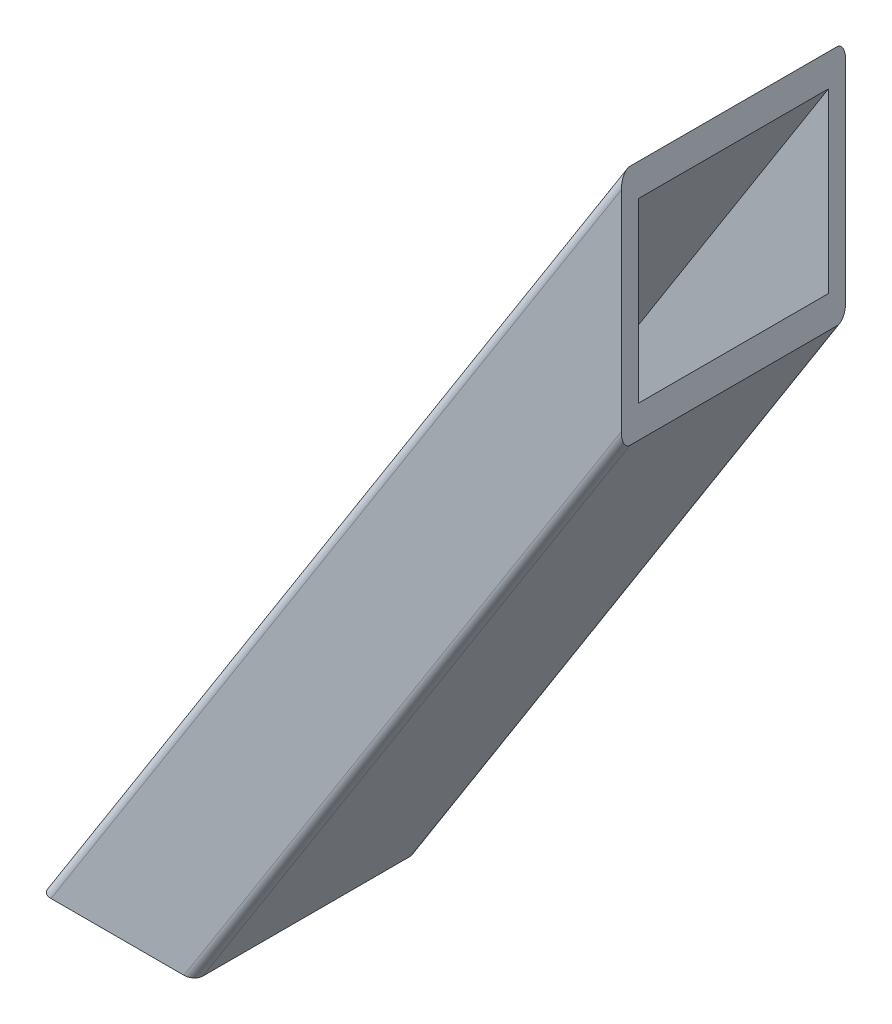
from build123d import *

# Parameters (mm, degrees)
BOSS_EXTRUDE1_DEPTH = 26
SHELL1_T            = -2
CUT_EXTRUDE1_REACH  = 120.071
SKETCH2_W           = 13.02701198
SKETCH2_H           = 22
FILLET1_R           = 1


with BuildPart() as part:
    # Sketch1 → Boss-Extrude1 (new body)
    with BuildSketch(Plane.XY):
        Polygon((0, 0), (-17.764107246, 0), (49.485727329, 106), (49.485727329, 78), align=None)
    extrude(amount=BOSS_EXTRUDE1_DEPTH)

    # Shell1
    shell1_openings = [part.faces().sort_by_distance(p)[0] for p in [
        (49.485727329, 92, 13),
    ]]
    offset(amount=SHELL1_T, openings=shell1_openings, kind=Kind.INTERSECTION)

    # Sketch2 → Cut-Extrude1 (cut, up to next)
    with BuildSketch(Plane(origin=(0, 2, 0), x_dir=(1, 0, 0), z_dir=(0, 1, 0)), mode=Mode.PRIVATE) as cut_extrude1_sk1:
        with Locations((-7.61318882, -13)):
            Rectangle(SKETCH2_W, SKETCH2_H)
    cut_extrude1_tool1 = extrude(cut_extrude1_sk1.sketch, amount=-CUT_EXTRUDE1_REACH, mode=Mode.PRIVATE) & part.part
    add(cut_extrude1_tool1.solids().sort_by_distance((-7.613189, 2, 13))[0], mode=Mode.SUBTRACT)

    # Fillet1
    fillet1_edges = [part.edges().sort_by_distance(p)[0] for p in [
        (15.860810041, 53, 26),
        (24.742863665, 39, 26),
        (15.860810041, 53, 0),
        (24.742863665, 39, 0),
    ]]
    fillet(fillet1_edges, radius=FILLET1_R)


solid = part.part
